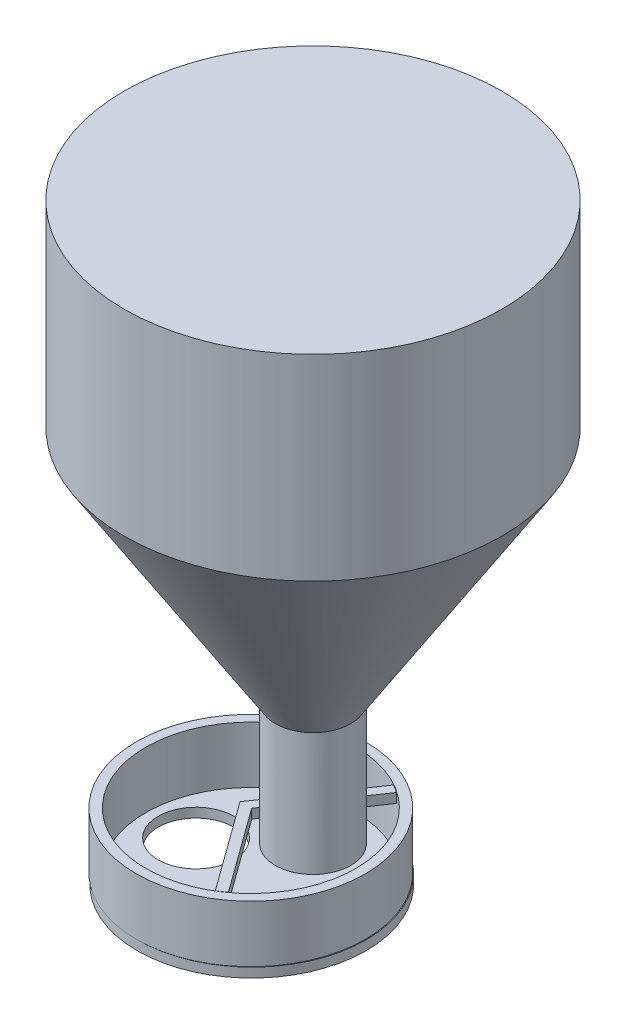
from build123d import *

# Parameters (mm, degrees)
CROQUIS1_R              = 100
SALIENTE_EXTRUIR1_DEPTH = 104
CROQUIS3_R              = 20
CROQUIS2_R              = 100
CROQUIS4_R              = 20
SALIENTE_EXTRUIR2_DEPTH = 65
CROQUIS7_R              = 17.5
CORTAR_EXTRUIR2_DEPTH   = 24
CROQUIS8_R              = 60.602826114
CROQUIS8_R_2            = 55.602826114
SALIENTE_EXTRUIR3_DEPTH = 30
CROQUIS10_R             = 60.602826114
CROQUIS10_R_2           = 20
SALIENTE_EXTRUIR5_DEPTH = 5
SALIENTE_EXTRUIR6_DEPTH = 5


with BuildPart() as part:
    # Croquis1 → Saliente-Extruir1 (new body)
    with BuildSketch(Plane(origin=(0, 0, 0), x_dir=(1, 0, 0), z_dir=(0, 1, 0))):
        with Locations(Location((0, 0, 0), (0, 0, 270))):
            Circle(CROQUIS1_R)
    extrude(amount=-SALIENTE_EXTRUIR1_DEPTH)

    # Croquis3 → Recubrir1 section 0
    with BuildSketch(Plane(origin=(0, -230, 0), x_dir=(1, 0, 0), z_dir=(0, 1, 0))):
        Circle(CROQUIS3_R)
    # Croquis2 → Recubrir1 section 1
    with BuildSketch(Plane.XZ.offset(104)):
        Circle(CROQUIS2_R)
    loft()

    # Croquis4 → Saliente-Extruir2 (add)
    with BuildSketch(Plane.XZ.offset(230)):
        with Locations(Location((0, 0, 0), (0, 0, 270))):
            Circle(CROQUIS4_R)
    extrude(amount=SALIENTE_EXTRUIR2_DEPTH)

    # Croquis7 → Cortar-Extruir2 (cut)
    with BuildSketch(Plane.XZ.offset(295)):
        with Locations(Location((0, 0, 0), (0, 0, 270))):
            Circle(CROQUIS7_R)
    extrude(amount=-CORTAR_EXTRUIR2_DEPTH, mode=Mode.SUBTRACT)


with BuildPart() as body_2:
    # Croquis8 → Saliente-Extruir3 (new body)
    with BuildSketch(Plane.XZ.offset(295)):
        with Locations(Location((-32.893475565, 0, 0), (0, 0, 270))):
            Circle(CROQUIS8_R)
        with Locations(Location((-32.893475565, 0, 0), (0, 0, 270))):
            Circle(CROQUIS8_R_2, mode=Mode.SUBTRACT)
    extrude(amount=SALIENTE_EXTRUIR3_DEPTH)

    # Croquis10 → Saliente-Extruir5 (add)
    with BuildSketch(Plane.XZ.offset(325)):
        with Locations(Location((-32.443615628, 0, 0), (0, 0, 90.212656212))):
            Circle(CROQUIS10_R)
        with Locations(Location((-63.53778642, -1.617860302, 0), (0, 0, 270))):
            Circle(CROQUIS10_R_2, mode=Mode.SUBTRACT)
    extrude(amount=SALIENTE_EXTRUIR5_DEPTH)


with BuildPart() as body_3:
    # Croquis11 → Saliente-Extruir6 (new body)
    with BuildSketch(Plane(origin=(0, -295, 0), x_dir=(1, 0, 0), z_dir=(0, 1, 0))):
        with BuildLine():
            Line((-0.108415749, -44.679799988), (-32.443615628, 0))
            Line((-32.443615628, 0), (-1.357702125, 45.557827647))
            ThreePointArc((-1.357702125, 45.557827647), (-3.456916322, 46.921433711), (-5.615842275, 48.188382989))
            Line((-5.615842275, 48.188382989), (-38.554414262, -0.084600379))
            Line((-38.554414262, -0.084600379), (-4.292100921, -47.42722739))
            ThreePointArc((-4.292100921, -47.42722739), (-2.169076001, -46.100997045), (-0.108415749, -44.679799988))
        make_face()
    extrude(amount=-SALIENTE_EXTRUIR6_DEPTH)


solid = Compound([part.part, body_2.part, body_3.part])
